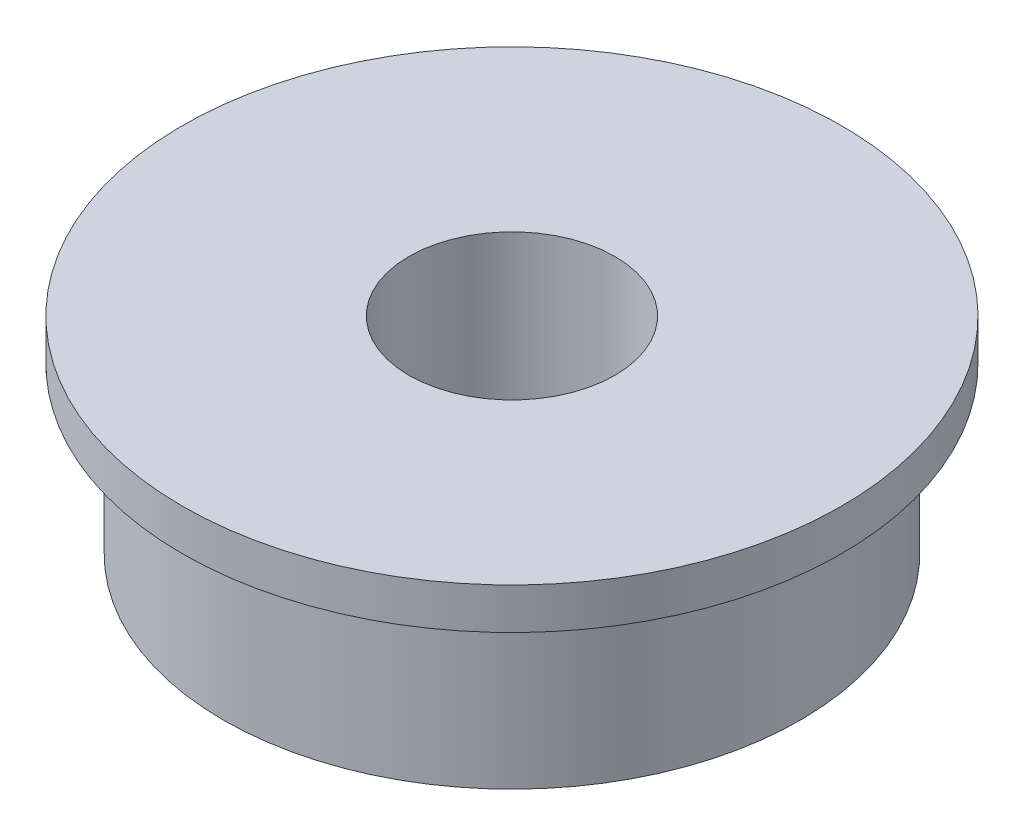
from build123d import *

# Parameters (mm, degrees)
SKETCH_1_R      = 7
SKETCH_1_R_2    = 2.5
EXTRUDE_1_DEPTH = 5
SKETCH_2_R      = 8
SKETCH_2_R_2    = 5.723236362
EXTRUDE_2_DEPTH = 1


with BuildPart() as part:
    # 스케치1 → 보스-돌출1 (new body)
    with BuildSketch(Plane(origin=(0, 0, 0), x_dir=(1, 0, 0), z_dir=(0, 1, 0))):
        with Locations(Location((0, 0, 0), (0, 0, 270))):
            Circle(SKETCH_1_R)
        with Locations(Location((0, 0, 0), (0, 0, 270))):
            Circle(SKETCH_1_R_2, mode=Mode.SUBTRACT)
    extrude(amount=EXTRUDE_1_DEPTH)

    # 스케치2 → 보스-돌출2 (add)
    with BuildSketch(Plane(origin=(0, 5, 0), x_dir=(1, 0, 0), z_dir=(0, 1, 0))):
        with Locations(Location((0, 0, 0), (0, 0, 270))):
            Circle(SKETCH_2_R)
        Circle(SKETCH_2_R_2, mode=Mode.SUBTRACT)
    extrude(amount=-EXTRUDE_2_DEPTH)


solid = part.part
